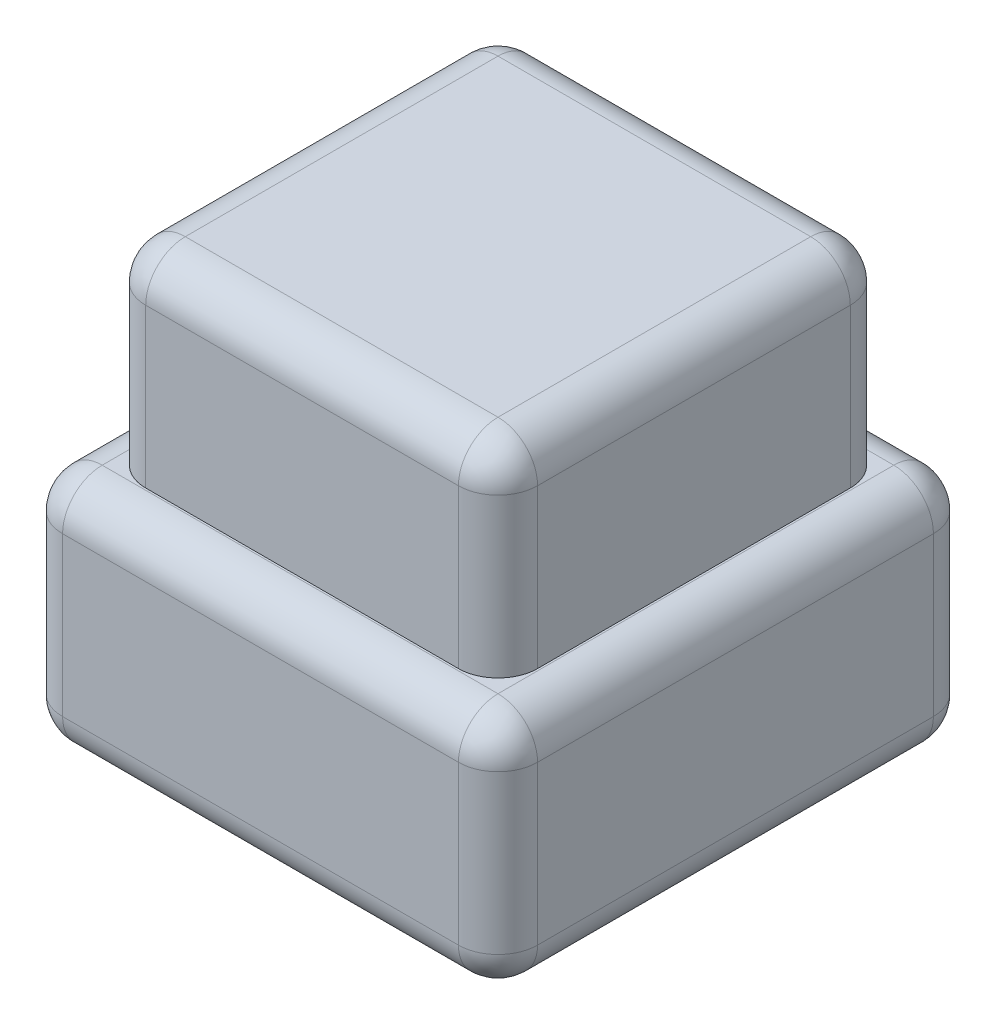
from build123d import *

# Parameters (mm, degrees)
SKETCH1_W           = 9.9
SKETCH1_H           = 9.9
BOSS_EXTRUDE1_DEPTH = 5
SKETCH2_W           = 12
SKETCH2_H           = 12
BOSS_EXTRUDE2_DEPTH = 6
SKETCH3_W           = 4
SKETCH3_H           = 4
CUT_EXTRUDE1_DEPTH  = 3
FILLET1_R           = 1


with BuildPart() as part:
    # Sketch1 → Boss-Extrude1 (new body)
    with BuildSketch(Plane(origin=(0, 0, 0), x_dir=(1, 0, 0), z_dir=(0, 1, 0))):
        Rectangle(SKETCH1_W, SKETCH1_H)
    extrude(amount=BOSS_EXTRUDE1_DEPTH)

    # Sketch2 → Boss-Extrude2 (add)
    with BuildSketch(Plane.XZ):
        Rectangle(SKETCH2_W, SKETCH2_H)
    extrude(amount=BOSS_EXTRUDE2_DEPTH)

    # Sketch3 → Cut-Extrude1 (cut)
    with BuildSketch(Plane.XZ.offset(6)):
        Rectangle(SKETCH3_W, SKETCH3_H)
    extrude(amount=-CUT_EXTRUDE1_DEPTH, mode=Mode.SUBTRACT)

    # Fillet1
    fillet1_edges = [part.edges().sort_by_distance(p)[0] for p in [
        (4.95, 5, 0),
        (6, 0, 0),
        (6, -3, -6),
        (0, 0, 6),
        (6, -3, 6),
        (-6, 0, 0),
        (-6, -3, 6),
        (0, 0, -6),
        (-6, -3, -6),
        (6, -6, 0),
        (0, -6, 6),
        (-6, -6, 0),
        (0, -6, -6),
        (0, 5, -4.95),
        (-2, -6, 0),
        (0, -6, -2),
        (2, -6, 0),
        (0, -6, 2),
        (-4.95, 5, 0),
        (-4.95, 2.5, -4.95),
        (4.95, 2.5, -4.95),
        (4.95, 2.5, 4.95),
        (-4.95, 2.5, 4.95),
        (0, 5, 4.95),
    ]]
    fillet(fillet1_edges, radius=FILLET1_R)


solid = part.part
